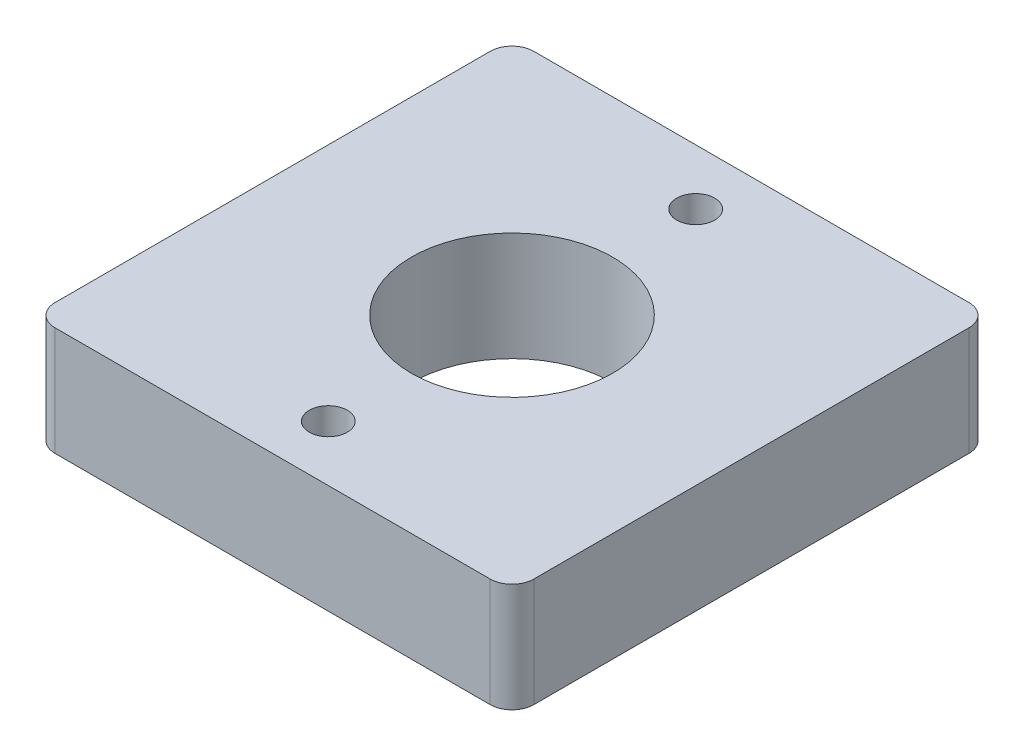
from build123d import *

# Parameters (mm, degrees)
CROQUIS1_W              = 44
CROQUIS1_H              = 44
CROQUIS1_R              = 9.25
SALIENTE_EXTRUIR1_DEPTH = 10
CROQUIS2_R              = 1.75
CORTAR_EXTRUIR1_DEPTH   = 33.680269277
REDONDEO1_R             = 2


with BuildPart() as part:
    # Croquis1 → Saliente-Extruir1 (new body)
    with BuildSketch(Plane(origin=(0, 0, 0), x_dir=(1, 0, 0), z_dir=(0, 1, 0))):
        Rectangle(CROQUIS1_W, CROQUIS1_H)
        with Locations(Location((0, 0, 0), (0, 0, 270))):
            Circle(CROQUIS1_R, mode=Mode.SUBTRACT)
    extrude(amount=SALIENTE_EXTRUIR1_DEPTH)

    # Croquis2 → Cortar-Extruir1 (cut, through all)
    with BuildSketch(Plane(origin=(0, 10, 0), x_dir=(1, 0, 0), z_dir=(0, 1, 0))):
        with Locations(Location((0, 16.88, 0), (0, 0, 270))):
            Circle(CROQUIS2_R)
        with Locations(Location((0, -16.88, 0), (0, 0, 270))):
            Circle(CROQUIS2_R)
    extrude(amount=-CORTAR_EXTRUIR1_DEPTH, mode=Mode.SUBTRACT)

    # Redondeo1
    redondeo1_edges = [part.edges().sort_by_distance(p)[0] for p in [
        (22, 5, 22),
        (-22, 5, 22),
        (-22, 5, -22),
        (22, 5, -22),
    ]]
    fillet(redondeo1_edges, radius=REDONDEO1_R)


solid = part.part
